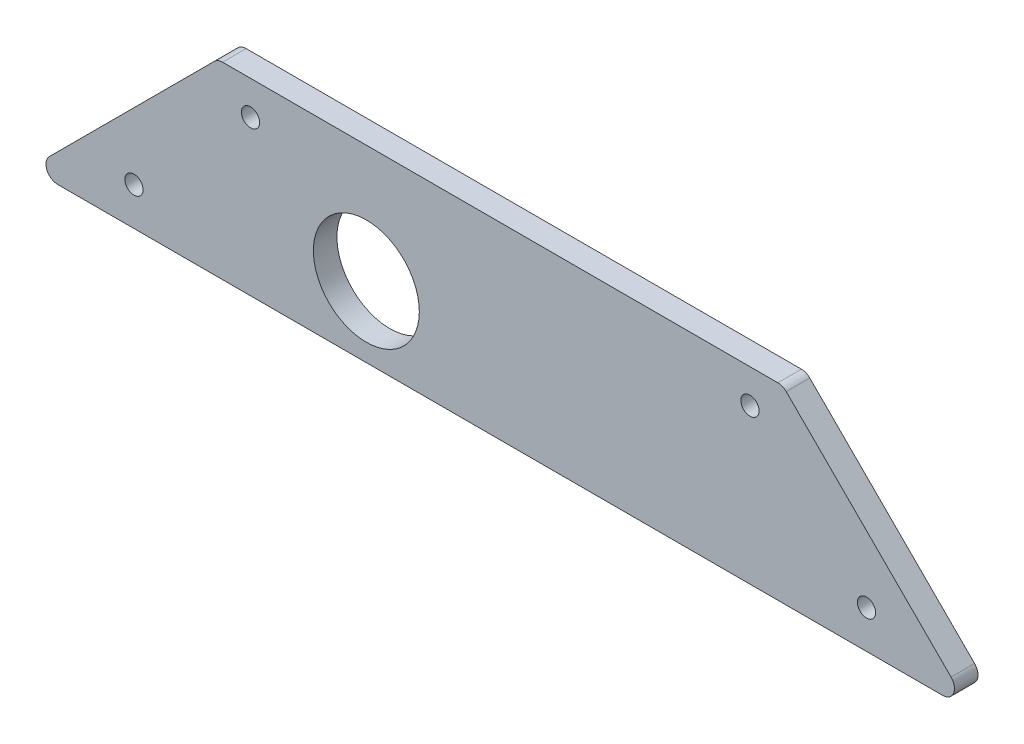
from build123d import *

# Parameters (mm, degrees)
BOSS_EXTRUDE1_DEPTH          = 3.175
SKETCH2_R                    = 14.2875
CUT_EXTRUDE1_DEPTH           = 131.459778054
F_10_0_1935_DIAMETER_HOLE2_D = 4.9149
FILLET1_R                    = 3.175


with BuildPart() as part:
    # Sketch1 → Boss-Extrude1 (new, symmetric)
    with BuildSketch(Plane.XY):
        Polygon((-76.2, 29.162153383), (-127, -21.637846617), (127, -21.637846617), (76.2, 29.162153383), align=None)
    extrude(amount=BOSS_EXTRUDE1_DEPTH, both=True)

    # Sketch2 → Cut-Extrude1 (cut, through all)
    with BuildSketch(Plane.XY.offset(3.175)):
        with Locations((-36.107951031, -2.587846617)):
            Circle(SKETCH2_R)
    extrude(amount=-CUT_EXTRUDE1_DEPTH, mode=Mode.SUBTRACT)

    # #10 (0.1935) Diameter Hole2 (through all)
    with Locations(Plane(origin=(67.351920908, 20.049720233, 3.175), x_dir=(1, 0, 0), z_dir=(0, 0, 1))):
        with Locations((0, 0), (31.430896424, -31.430896424), (-134.703841816, 0), (-166.13473824, -31.430896424)):
            Hole(F_10_0_1935_DIAMETER_HOLE2_D / 2)

    # Fillet1
    fillet1_edges = [part.edges().sort_by_distance(p)[0] for p in [
        (76.2, 29.162153383, 0),
        (127, -21.637846617, 0),
        (-127, -21.637846617, 0),
        (-76.2, 29.162153383, 0),
    ]]
    fillet(fillet1_edges, radius=FILLET1_R)


solid = part.part
